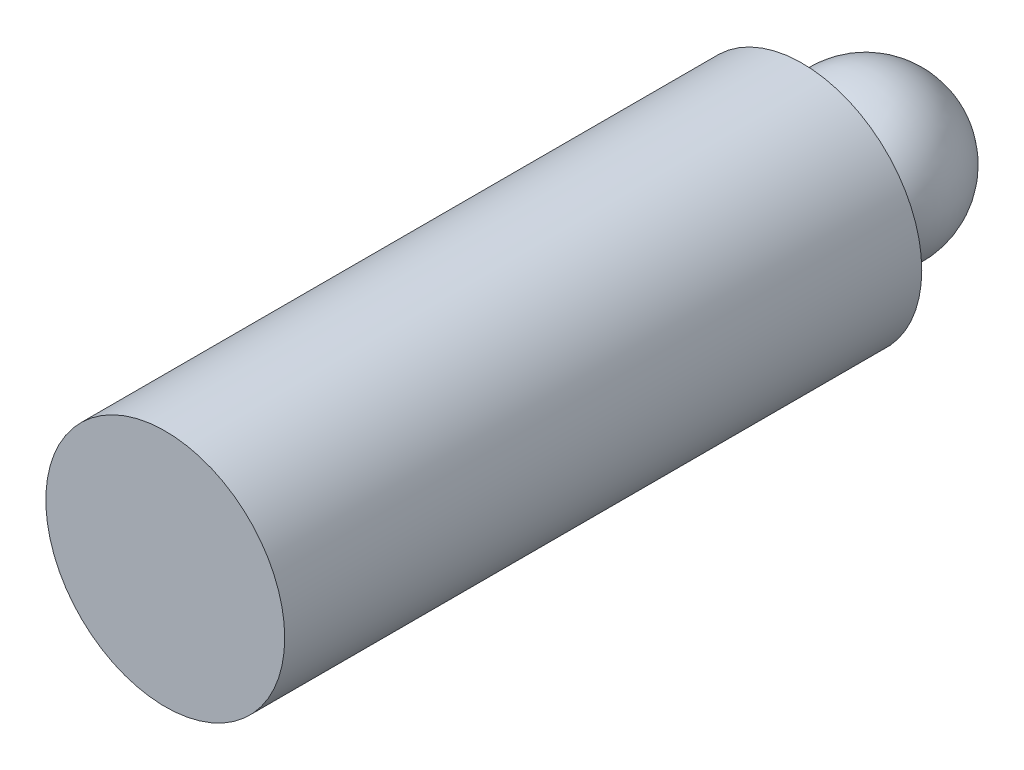
from build123d import *

# Parameters (mm, degrees)
SKETCH_1_R      = 15
EXTRUDE_1_DEPTH = 80


with BuildPart() as part:
    # 草图1 → 凸台-拉伸1 (new body)
    with BuildSketch(Plane.XY):
        Circle(SKETCH_1_R)
    extrude(amount=EXTRUDE_1_DEPTH)


with BuildPart() as body_2:
    # 草图3 → 旋转1 (revolve)
    with BuildSketch(Plane(origin=(0, 0, 0), x_dir=(1, 0, 0), z_dir=(0, 1, 0))):
        with BuildLine():
            Line((0, 17.941537566), (0, -2.058462434))
            ThreePointArc((0, -2.058462434), (-10, 7.941537566), (0, 17.941537566))
        make_face()
    revolve(axis=Axis((0, 0, -17.941537566), (0, 0, 1)))


solid = Compound([part.part, body_2.part])
